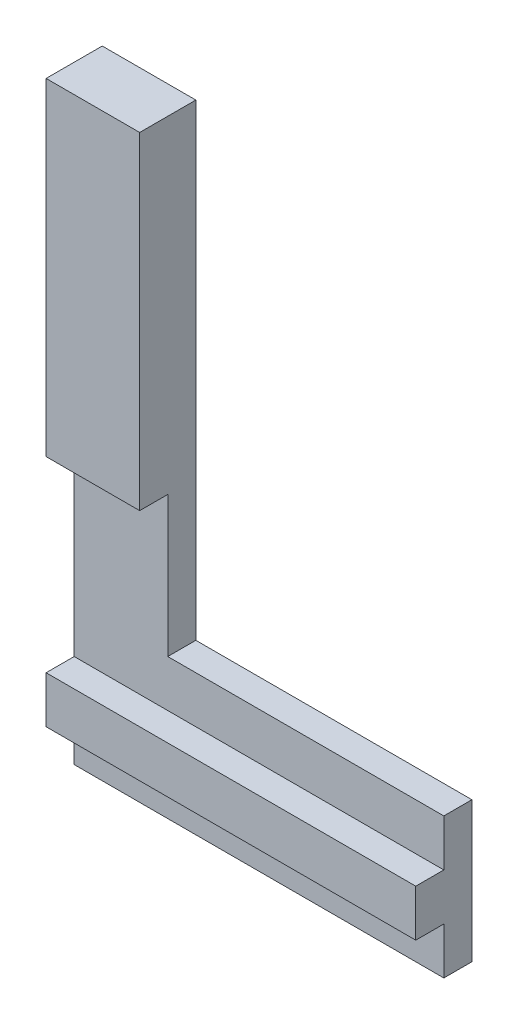
from build123d import *

# Parameters (mm, degrees)
SKETCH1_W           = 20
SKETCH1_H           = 100
BOSS_EXTRUDE4_DEPTH = 6
BOSS_EXTRUDE5_DEPTH = 6
SKETCH3_W           = 79
SKETCH3_H           = 10
BOSS_EXTRUDE6_DEPTH = 6
SKETCH6_W           = 20
SKETCH6_H           = 70
BOSS_EXTRUDE8_DEPTH = 6


with BuildPart() as part:
    # Sketch1 → Boss-Extrude4 (new body)
    with BuildSketch(Plane.XY):
        with Locations((10, 50)):
            Rectangle(SKETCH1_W, SKETCH1_H)
    extrude(amount=BOSS_EXTRUDE4_DEPTH)

    # Sketch1<8> → Boss-Extrude5 (add)
    with BuildSketch(Plane.XY):
        Polygon((20, 0), (0, 0), (0, -30), (79, -30), (79, 0), align=None)
    extrude(amount=BOSS_EXTRUDE5_DEPTH)

    # Sketch3 → Boss-Extrude6 (add)
    with BuildSketch(Plane.XY.offset(6)):
        with Locations((39.5, -15)):
            Rectangle(SKETCH3_W, SKETCH3_H)
    extrude(amount=BOSS_EXTRUDE6_DEPTH)

    # Sketch6 → Boss-Extrude8 (add)
    with BuildSketch(Plane.XY.offset(6)):
        with Locations((10, 65)):
            Rectangle(SKETCH6_W, SKETCH6_H)
    extrude(amount=BOSS_EXTRUDE8_DEPTH)


solid = part.part
